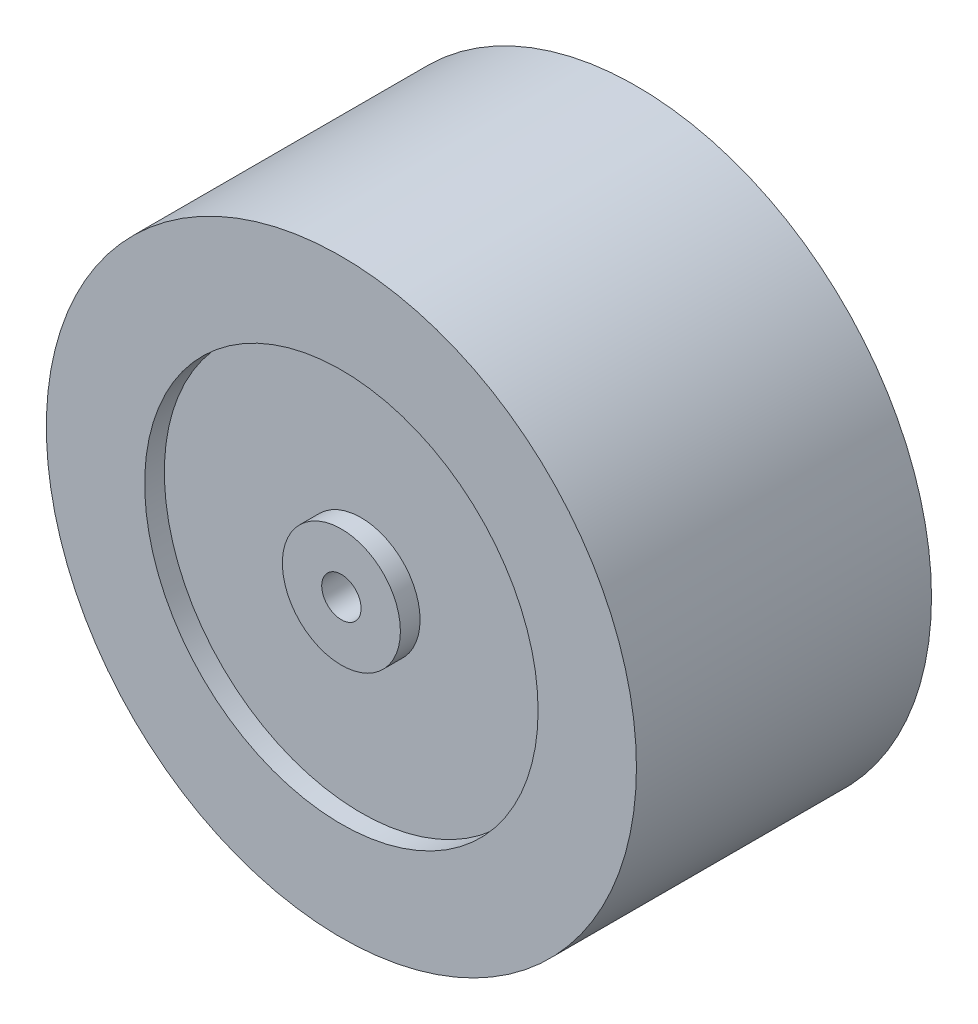
from build123d import *

# Parameters (mm, degrees)
SKIZZE1_R                       = 300
AUFSATZ_LINEAR_AUSTRAGEN1_DEPTH = 300
SKIZZE2_R                       = 20
SCHNITT_LINEAR_AUSTRAGEN1_DEPTH = 300
SKIZZE3_R                       = 200
SKIZZE3_R_2                     = 60
SCHNITT_LINEAR_AUSTRAGEN2_DEPTH = 20


with BuildPart() as part:
    # Skizze1 → Aufsatz-Linear austragen1 (new body)
    with BuildSketch(Plane.XY):
        Circle(SKIZZE1_R)
    extrude(amount=AUFSATZ_LINEAR_AUSTRAGEN1_DEPTH)

    # Skizze2 → Schnitt-Linear austragen1 (cut)
    with BuildSketch(Plane.XY.offset(300)):
        Circle(SKIZZE2_R)
    extrude(amount=-SCHNITT_LINEAR_AUSTRAGEN1_DEPTH, mode=Mode.SUBTRACT)

    # Skizze3 → Schnitt-Linear austragen2 (cut)
    with BuildSketch(Plane.XY.offset(300)):
        Circle(SKIZZE3_R)
        Circle(SKIZZE3_R_2, mode=Mode.SUBTRACT)
    extrude(amount=-SCHNITT_LINEAR_AUSTRAGEN2_DEPTH, mode=Mode.SUBTRACT)


solid = part.part
